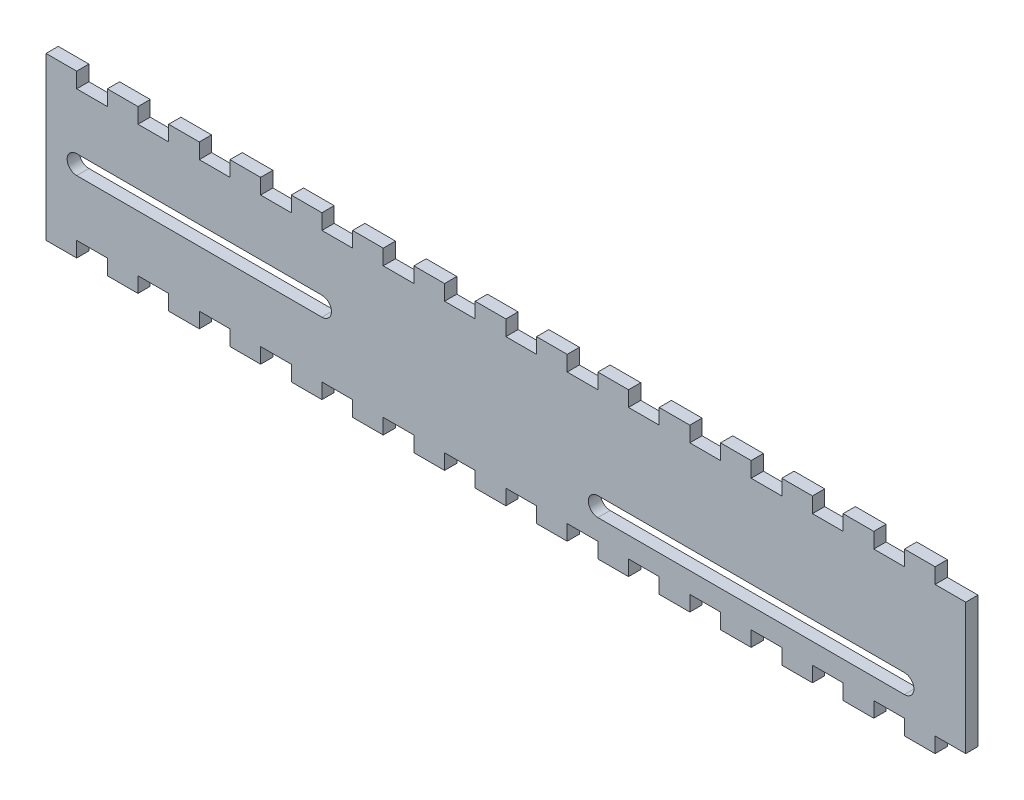
from build123d import *

# Parameters (mm, degrees)
SKETCH1_W           = 150
SKETCH1_H           = 21.4
BOSS_EXTRUDE2_DEPTH = 2
SKETCH2_W           = 5
SKETCH2_H           = 2
BOSS_EXTRUDE3_DEPTH = 2.5
LPATTERN1_COUNT     = 15
LPATTERN1_PITCH     = 10
SKETCH3_W           = 5
SKETCH3_H           = 2
BOSS_EXTRUDE4_DEPTH = 2.5
LPATTERN2_COUNT     = 15
LPATTERN2_PITCH     = 10
CUT_EXTRUDE1_DEPTH  = 10


with BuildPart() as part:
    # Sketch1 → Boss-Extrude2 (new body)
    with BuildSketch(Plane.XY):
        with Locations((75, 10.7)):
            Rectangle(SKETCH1_W, SKETCH1_H)
    extrude(amount=BOSS_EXTRUDE2_DEPTH)

    # Sketch2 → Boss-Extrude3 (add)
    with BuildSketch(Plane(origin=(0, 21.4, 0), x_dir=(1, 0, 0), z_dir=(0, 1, 0))):
        with Locations((2.5, -1)):
            Rectangle(SKETCH2_W, SKETCH2_H)
    boss_extrude3 = extrude(amount=BOSS_EXTRUDE3_DEPTH)

    # LPattern1: Boss-Extrude3 ×15
    with Locations(*[(i * LPATTERN1_PITCH, 0, 0) for i in range(1, LPATTERN1_COUNT)]):
        add(boss_extrude3)

    # Sketch3 → Boss-Extrude4 (add)
    with BuildSketch(Plane(origin=(0, 0, 0), x_dir=(-1, 0, 0), z_dir=(0, -1, 0))):
        with Locations((-2.5, -1)):
            Rectangle(SKETCH3_W, SKETCH3_H)
    boss_extrude4 = extrude(amount=BOSS_EXTRUDE4_DEPTH)

    # LPattern2: Boss-Extrude4 ×15
    with Locations(*[(i * LPATTERN2_PITCH, 0, 0) for i in range(1, LPATTERN2_COUNT)]):
        add(boss_extrude4)

    # Sketch4 → Cut-Extrude1 (cut)
    with BuildSketch(Plane(origin=(0, 0, 0), x_dir=(-1, 0, 0), z_dir=(0, 0, -1))):
        with BuildLine():
            Line((-140, 6.45), (-90, 6.45))
            ThreePointArc((-90, 6.45), (-88.45, 4.9), (-90, 3.35))
            Line((-90, 3.35), (-140, 3.35))
            ThreePointArc((-140, 3.35), (-141.55, 4.9), (-140, 6.45))
        make_face()
        with BuildLine():
            Line((-45, 12.25), (-5, 12.25))
            ThreePointArc((-5, 12.25), (-3.45, 10.7), (-5, 9.15))
            Line((-5, 9.15), (-45, 9.15))
            ThreePointArc((-45, 9.15), (-46.55, 10.7), (-45, 12.25))
        make_face()
    extrude(amount=-CUT_EXTRUDE1_DEPTH, mode=Mode.SUBTRACT)


solid = part.part
